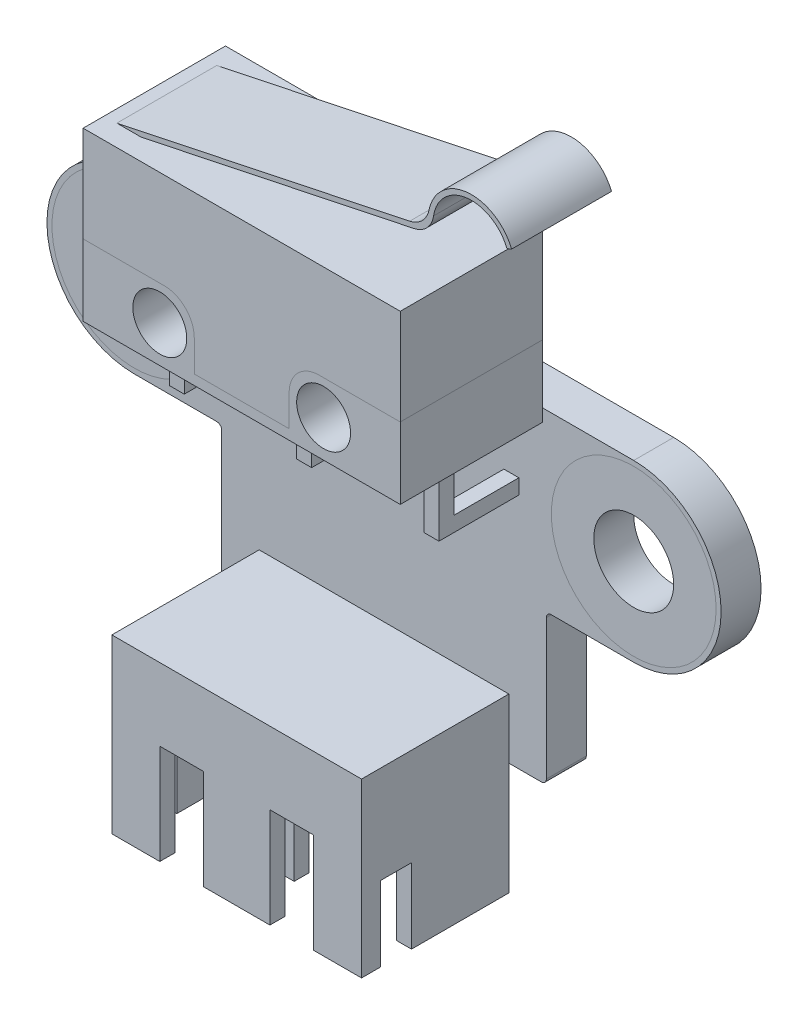
from build123d import *

# Parameters (mm, degrees)
SKICA1_R                 = 1.6
P_IDAT_VYSUNUT_M1_DEPTH  = 1.6
SKICA2_W                 = 12.7
SKICA2_H                 = 6.7
P_IDAT_VYSUNUT_M2_DEPTH  = 5.7
SKICA3_W                 = 10
SKICA3_H                 = 6.9
P_IDAT_VYSUNUT_M3_DEPTH  = 5.9
SKICA4_W                 = 8.8
SKICA4_H                 = 4.7
SKICA4_W_2               = 0.6
SKICA4_H_2               = 0.6
ODEBRAT_VYSUNUT_M1_DEPTH = 5.4
SKICA5_W                 = 1.25
SKICA5_H                 = 3
ODEBRAT_VYSUNUT_M2_DEPTH = 11.4
SKICA6_W                 = 1.75
SKICA6_H                 = 4
ODEBRAT_VYSUNUT_M3_DEPTH = 1
ZAOBLIT1_R               = 0.2
SKICA8_R                 = 1.08
ODEBRAT_VYSUNUT_M4_DEPTH = 5.7
P_IDAT_VYSUNUT_M4_DEPTH  = 2
SKICA16_W                = 0.6
SKICA16_H                = 3
P_IDAT_VYSUNUT_M5_DEPTH  = 3.2
SKICA17_W                = 2.6
SKICA17_H                = 2.4
ODEBRAT_VYSUNUT_M6_DEPTH = 12


with BuildPart() as part:
    # Skica1 → Přidat vysunutím1 (new body)
    with BuildSketch(Plane.XY):
        with BuildLine():
            Line((0, 3.5), (20, 3.5))
            ThreePointArc((20, 3.5), (23.5, 0), (20, -3.5))
            Line((20, -3.5), (16.5, -3.5))
            Line((16.5, -3.5), (16.5, -9.5))
            Line((16.5, -9.5), (3.5, -9.5))
            Line((3.5, -9.5), (3.5, -3.5))
            Line((3.5, -3.5), (0, -3.5))
            ThreePointArc((0, -3.5), (-3.5, 0), (0, 3.5))
        make_face()
        Circle(SKICA1_R, mode=Mode.SUBTRACT)
        with Locations((20, 0)):
            Circle(SKICA1_R, mode=Mode.SUBTRACT)
    extrude(amount=P_IDAT_VYSUNUT_M1_DEPTH)

    # Skica2 → Přidat vysunutím2 (add)
    with BuildSketch(Plane.XY.offset(1.6)):
        with Locations((10, 6.35)):
            Rectangle(SKICA2_W, SKICA2_H)
    extrude(amount=P_IDAT_VYSUNUT_M2_DEPTH)

    # Skica3 → Přidat vysunutím3 (add)
    with BuildSketch(Plane.XY.offset(1.6)):
        with Locations((10, -10.55)):
            Rectangle(SKICA3_W, SKICA3_H)
    extrude(amount=P_IDAT_VYSUNUT_M3_DEPTH)

    # Skica4 → Odebrat vysunutím1 (cut)
    with BuildSketch(Plane.XZ.offset(14)):
        with Locations((10, 4.55)):
            Rectangle(SKICA4_W, SKICA4_H)
        with Locations((10, 5.2)):
            Rectangle(SKICA4_W_2, SKICA4_H_2, mode=Mode.SUBTRACT)
        with Locations((7.46, 5.2)):
            Rectangle(SKICA4_W_2, SKICA4_H_2, mode=Mode.SUBTRACT)
        with Locations((12.54, 5.2)):
            Rectangle(SKICA4_W_2, SKICA4_H_2, mode=Mode.SUBTRACT)
    extrude(amount=-ODEBRAT_VYSUNUT_M1_DEPTH, mode=Mode.SUBTRACT)

    # Skica5 → Odebrat vysunutím2 (cut)
    with BuildSketch(Plane(origin=(15, 0, 0), x_dir=(0, 0, -1), z_dir=(1, 0, 0))):
        with Locations((-6.125, -12.5)):
            Rectangle(SKICA5_W, SKICA5_H)
    extrude(amount=-ODEBRAT_VYSUNUT_M2_DEPTH, mode=Mode.SUBTRACT)

    # Skica6 → Odebrat vysunutím3 (cut)
    with BuildSketch(Plane.XY.offset(7.5)):
        with Locations((12.205, -12)):
            Rectangle(SKICA6_W, SKICA6_H)
        with Locations((7.795, -12)):
            Rectangle(SKICA6_W, SKICA6_H)
    extrude(amount=-ODEBRAT_VYSUNUT_M3_DEPTH, mode=Mode.SUBTRACT)

    # Zaoblit1
    zaoblit1_edges = [part.edges().sort_by_distance(p)[0] for p in [
        (16.5, -3.5, 0.8),
        (16.5, -9.5, 0.8),
        (3.5, -9.5, 0.8),
        (3.5, -3.5, 0.8),
    ]]
    fillet(zaoblit1_edges, radius=ZAOBLIT1_R)

    # Skica8 → Odebrat vysunutím4 (cut)
    with BuildSketch(Plane(origin=(0, -2.8, 7.3), x_dir=(1, 0, 0), z_dir=(0, 0, -1))):
        with Locations(Location((6.72, -7.28, 0), (0, 0, 65.14949766))):
            Circle(SKICA8_R)
        with Locations(Location((13.28, -7.28, 0), (0, 0, 65.14949766))):
            Circle(SKICA8_R)
    extrude(amount=ODEBRAT_VYSUNUT_M4_DEPTH, mode=Mode.SUBTRACT)

    # Skica15 → Přidat vysunutím4 (add, symmetric)
    with BuildSketch(Plane.XY.offset(4.45)):
        with BuildLine():
            Line((4.15, 9.7), (15.877570704, 12.162837052))
            ThreePointArc((15.877570704, 12.162837052), (16.38053334, 12.435762524), (16.651496116, 12.939785241))
            ThreePointArc((16.651496116, 12.939785241), (18.195492273, 14.317249988), (19.959455422, 13.23569219))
            Line((19.959455422, 13.23569219), (19.773836138, 13.161224202))
            ThreePointArc((19.773836138, 13.161224202), (18.174243185, 14.114045924), (16.833517959, 12.822139302))
            ThreePointArc((16.833517959, 12.822139302), (16.571348331, 12.286093255), (16.05055336, 11.994801518))
            Line((16.05055336, 11.994801518), (5.123136532, 9.7))
            Line((5.123136532, 9.7), (4.15, 9.7))
        make_face()
    extrude(amount=P_IDAT_VYSUNUT_M4_DEPTH, both=True)

    # Skica16 → Přidat vysunutím5 (add)
    with BuildSketch(Plane.XY.offset(4.8)):
        with Locations((4.9, 1.5)):
            Rectangle(SKICA16_W, SKICA16_H)
        with Locations((10, 1.5)):
            Rectangle(SKICA16_W, SKICA16_H)
        with Locations((15.1, 1.5)):
            Rectangle(SKICA16_W, SKICA16_H)
    extrude(amount=-P_IDAT_VYSUNUT_M5_DEPTH)

    # Skica17 → Odebrat vysunutím6 (cut)
    with BuildSketch(Plane(origin=(15.4, 0, 0), x_dir=(0, 0, -1), z_dir=(1, 0, 0))):
        with Locations((-2.9, 1.8)):
            Rectangle(SKICA17_W, SKICA17_H)
    extrude(amount=-ODEBRAT_VYSUNUT_M6_DEPTH, mode=Mode.SUBTRACT)


solid = part.part
